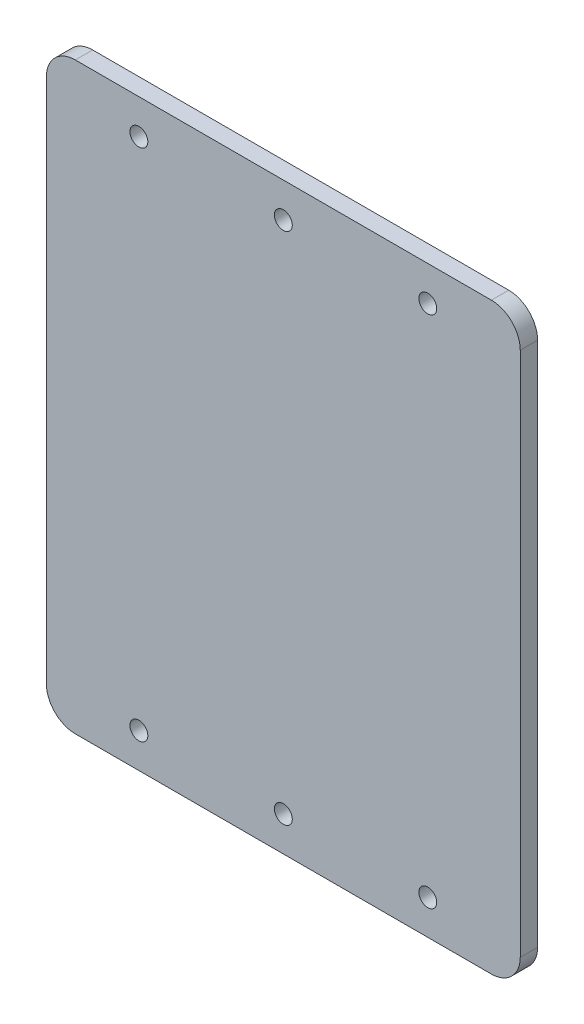
from build123d import *

# Parameters (mm, degrees)
SKETCH_1_W      = 82
SKETCH_1_H      = 101
SKETCH_1_R      = 1.55
EXTRUDE_1_DEPTH = 3
FILLET_1_R      = 5


with BuildPart() as part:
    # 草图1 → 凸台-拉伸1 (new body)
    with BuildSketch(Plane.XY):
        with Locations((41, 50.5)):
            Rectangle(SKETCH_1_W, SKETCH_1_H)
        with Locations((41, 6)):
            Circle(SKETCH_1_R, mode=Mode.SUBTRACT)
        with Locations((66, 6)):
            Circle(SKETCH_1_R, mode=Mode.SUBTRACT)
        with Locations((16, 6)):
            Circle(SKETCH_1_R, mode=Mode.SUBTRACT)
        with Locations((41, 95)):
            Circle(SKETCH_1_R, mode=Mode.SUBTRACT)
        with Locations((66, 95)):
            Circle(SKETCH_1_R, mode=Mode.SUBTRACT)
        with Locations((16, 95)):
            Circle(SKETCH_1_R, mode=Mode.SUBTRACT)
    extrude(amount=EXTRUDE_1_DEPTH)

    # 圆角1
    fillet_1_edges = [part.edges().sort_by_distance(p)[0] for p in [
        (0, 101, 1.5),
        (82, 101, 1.5),
        (82, 0, 1.5),
        (0, 0, 1.5),
    ]]
    fillet(fillet_1_edges, radius=FILLET_1_R)


solid = part.part
